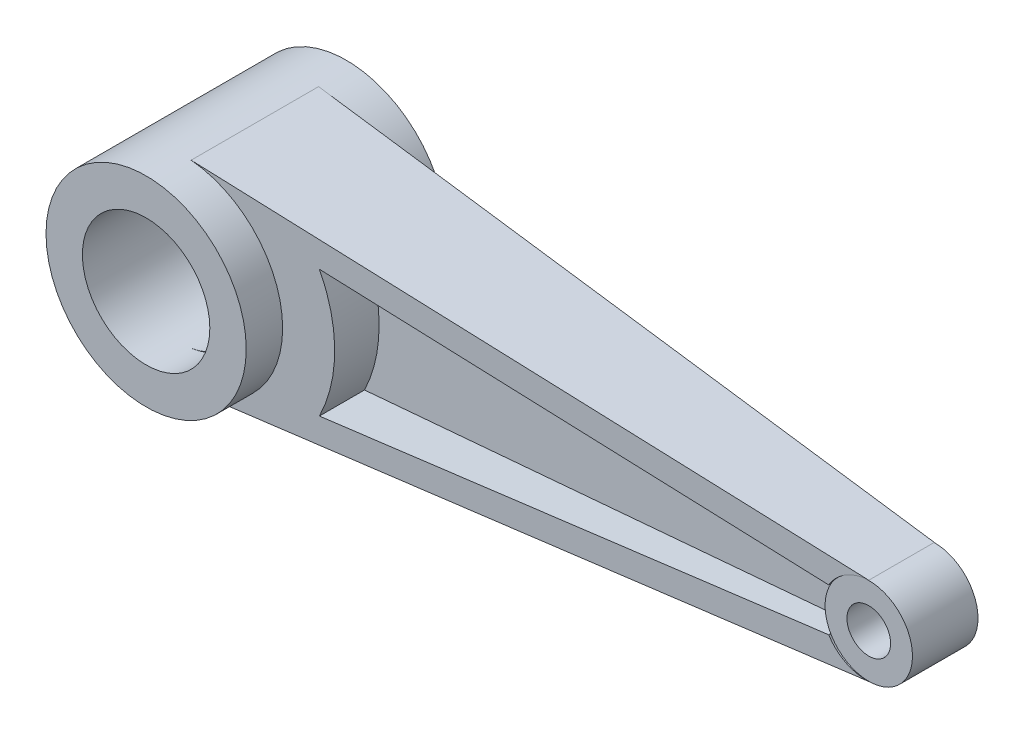
from build123d import *

# Parameters (mm, degrees)
SKETCH1_R               = 27.5
SKETCH1_R_2             = 17.5
BOSS_EXTRUDE2_DEPTH     = 27.5
SKETCH2_R               = 12
SKETCH2_R_2             = 6
BOSS_EXTRUDE3_DEPTH     = 9
BOSS_EXTRUDE4_DEPTH     = 17.5
BOSS_EXTRUDE5_DEPTH     = 3.5
CUT_EXTRUDE2_DEPTH      = 196.899208778
CUT_EXTRUDE2_DEPTH_BACK = 196.899208778


with BuildPart() as part:
    # Sketch1 → Boss-Extrude2 (new, symmetric)
    with BuildSketch(Plane.XY):
        Circle(SKETCH1_R)
        Circle(SKETCH1_R_2, mode=Mode.SUBTRACT)
    extrude(amount=BOSS_EXTRUDE2_DEPTH, both=True)

    # Sketch5 → Boss-Extrude4 (add, symmetric)
    with BuildSketch(Plane.XY):
        with BuildLine():
            Line((180, 12.044739708), (2.368055556, 27.397852341))
            ThreePointArc((2.368055556, 27.397852341), (27.475116905, 1.169594392), (4.687879819, -27.097486651))
            Line((4.687879819, -27.097486651), (180, -12.044739708))
            ThreePointArc((180, -12.044739708), (173.929153007, -10.40291168), (169.513349957, -5.925025359))
            Line((169.513349957, -5.925025359), (35.985184383, -17.466153122))
            ThreePointArc((35.985184383, -17.466153122), (40, 0), (35.985184383, 17.466153122))
            Line((35.985184383, 17.466153122), (169.513349957, 5.925025359))
            ThreePointArc((169.513349957, 5.925025359), (173.929153007, 10.40291168), (180, 12.044739708))
        make_face()
    extrude(amount=BOSS_EXTRUDE4_DEPTH, both=True)

    # Sketch5<3> → Boss-Extrude5 (add, symmetric)
    with BuildSketch(Plane.XY):
        with BuildLine():
            Line((169.513349957, 5.925025359), (35.985184383, 17.466153122))
            ThreePointArc((35.985184383, 17.466153122), (40, 0), (35.985184383, -17.466153122))
            Line((35.985184383, -17.466153122), (169.513349957, -5.925025359))
            ThreePointArc((169.513349957, -5.925025359), (167.955260292, 0), (169.513349957, 5.925025359))
        make_face()
    extrude(amount=BOSS_EXTRUDE5_DEPTH, both=True)

    # Sketch8 → Cut-Extrude2 (cut, two sides: drawn at the far end of the back side and taken through both)
    with BuildSketch(Plane(origin=(0, 0, 0), x_dir=(1, 0, 0), z_dir=(0, 1, 0)).offset(-CUT_EXTRUDE2_DEPTH_BACK)):
        Polygon((2.368055556, 17.5), (180, 9), (180, 17.5), align=None)
        Polygon((180, -9), (180, -17.5), (2.368055556, -17.5), align=None)
    extrude(amount=CUT_EXTRUDE2_DEPTH + CUT_EXTRUDE2_DEPTH_BACK, mode=Mode.SUBTRACT)


with BuildPart() as body_2:
    # Sketch2 → Boss-Extrude3 (new, symmetric)
    with BuildSketch(Plane.XY):
        with Locations((180, 0)):
            Circle(SKETCH2_R)
        with Locations((180, 0)):
            Circle(SKETCH2_R_2, mode=Mode.SUBTRACT)
    extrude(amount=BOSS_EXTRUDE3_DEPTH, both=True)


solid = Compound([part.part, body_2.part])
